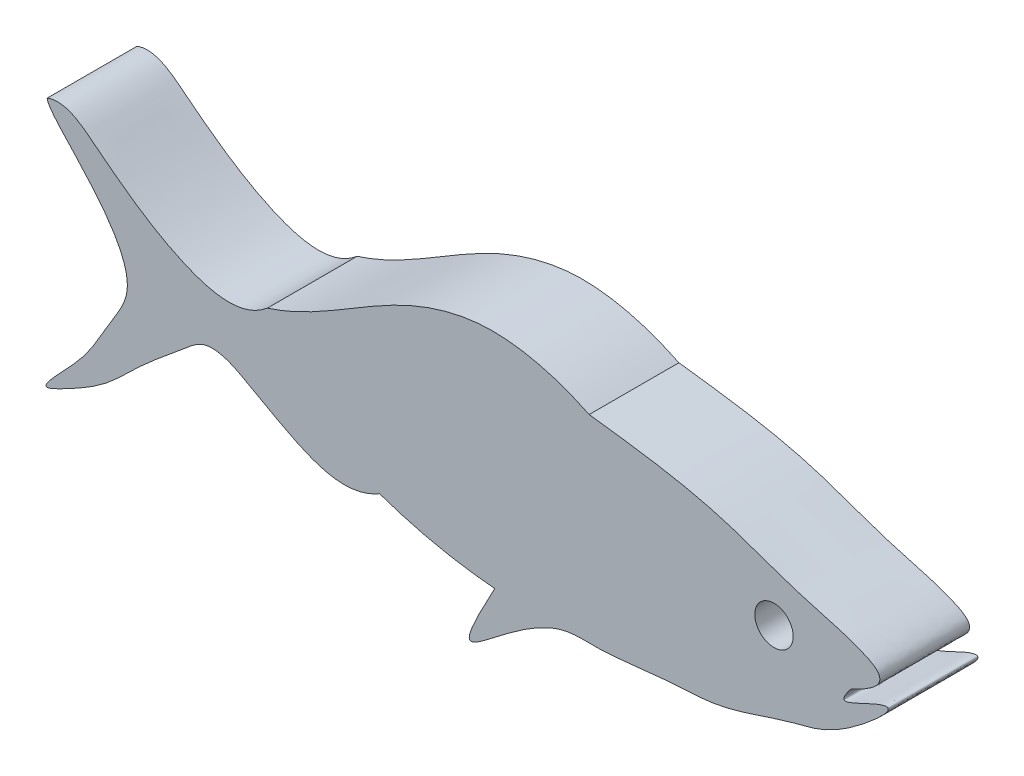
from build123d import *

# Parameters (mm, degrees)
SKETCH1_R           = 0.856198578
BOSS_EXTRUDE1_DEPTH = 4
SKETCH3_R           = 1.5
CUT_EXTRUDE1_DEPTH  = 9


with BuildPart() as part:
    # Sketch1 → Boss-Extrude1 (new body)
    with BuildSketch(Plane.XY):
        with BuildLine():
            add(Edge.make_bspline(
                [(0, -4.071683328), (-2.643041145, -3.854322253), (-5.134152479, -2.980149273)],
                knots=[0, 0, 0, 1, 1, 1], degree=2))
            add(Edge.make_bspline(
                [(-5.134152479, -2.980149273), (-6.600264496, -3.836705809), (-8.624233363, -3.021161079), (-10.785697732, -1.782596349), (-11.978260684, -1.123229722), (-13.036291247, -1.040429162), (-14.266936489, -2.107409234), (-15.575671893, -3.1311168), (-17.208529639, -4.794138392), (-18.251522936, -5.483073611), (-20.513307915, -6.644608862), (-18.962424412, -5.011003436), (-18.051410845, -4.01748307), (-17.177797847, -2.399261603), (-15.17116587, 0.685726553), (-19.949825339, 4.189932819), (-19.944735597, 4.884405409)],
                knots=[0, 0, 0, 0, 0.138389722, 0.206906063, 0.246748514, 0.271840694, 0.305080284, 0.398465097, 0.44272389, 0.52456478, 0.560245502, 0.603348228, 0.653722513, 0.724778836, 0.775116046, 1, 1, 1, 1], degree=3))
            add(Edge.make_bspline(
                [(-19.944735597, 4.884405409), (-19.107544328, 5.207768015), (-17.730008354, 4.03766376), (-15.89343661, 2.654513041), (-13.450332328, 1.204275995), (-11.2569078, 0.734625306), (-10.133112873, 1.683537147)],
                knots=[0, 0, 0, 0, 0.228016033, 0.426642533, 0.652701293, 1, 1, 1, 1], degree=3))
            add(Edge.make_bspline(
                [(-10.133112873, 1.683537147), (-7.821848618, 2.414748647), (-5.059410251, 4.765876744), (0.022915411, 6.212163056), (2.796232142, 5.427029266), (4.206796527, 4.746455334)],
                knots=[0, 0, 0, 0, 0.466637184, 0.691355155, 1, 1, 1, 1], degree=3))
            add(Edge.make_bspline(
                [(15.886704939, 0), (17.904571057, 0.901587329), (16.25771186, 1.860138812), (13.442166737, 2.465066652), (9.518066413, 4.090162687), (6.197597234, 4.492579018), (4.206796527, 4.746455334)],
                knots=[0, 0, 0, 0, 0.160361296, 0.331409232, 0.596131317, 1, 1, 1, 1], degree=3))
            add(Edge.make_bspline(
                [(0, -4.071683328), (-2.949070262, -9.489012813), (1.102896286, -3.867120249), (5.069435368, -4.149145791), (7.344841141, -3.741970651), (10.257895427, -3.727370048), (13.086894177, -2.52788309), (15.165492902, -2.2915012), (18.156838529, 0.34479431), (16.416596819, -0.200758472), (14.949193397, -1.18142842), (15.886704939, 0)],
                knots=[0, 0, 0, 0, 0.29636587, 0.351295347, 0.477374603, 0.561694797, 0.696649302, 0.80229775, 0.898253063, 0.910816622, 1, 1, 1, 1], degree=3))
        make_face()
        with Locations((12.442831964, 0.727358699)):
            Circle(SKETCH1_R, mode=Mode.SUBTRACT)
    extrude(amount=BOSS_EXTRUDE1_DEPTH)

    # Sketch3 → Cut-Extrude1 (cut)
    with BuildSketch(Plane(origin=(0, -10, 0), x_dir=(1, 0, 0), z_dir=(0, 1, 0))):
        with Locations(Location((-5.134152479, -2, 0), (0, 0, 270))):
            Circle(SKETCH3_R)
    extrude(amount=CUT_EXTRUDE1_DEPTH, mode=Mode.SUBTRACT)


solid = part.part
